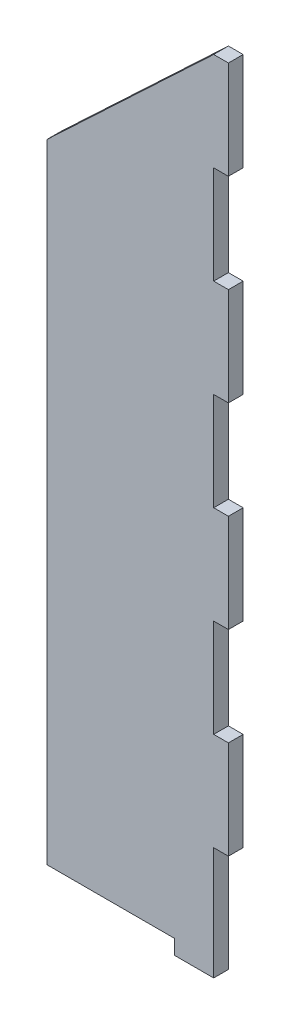
from build123d import *

# Parameters (mm, degrees)
BOSS_EXTRUDE1_DEPTH = 4.7625


with BuildPart() as part:
    # Sketch1 → Boss-Extrude1 (new body)
    with BuildSketch(Plane.XY):
        Polygon((-26.9875, -101.6), (14.2875, -101.6), (14.2875, -106.3625), (26.9875, -106.3625), (26.9875, -69.85), (31.75, -69.85), (31.75, -38.1), (26.9875, -38.1), (26.9875, -6.35), (31.75, -6.35), (31.75, 25.4), (26.9875, 25.4), (26.9875, 57.15), (31.75, 57.15), (31.75, 88.9), (26.9875, 88.9), (26.9875, 120.65), (31.75, 120.65), (31.75, 152.4), (26.9875, 152.4), (-26.9875, 101.6), align=None)
    extrude(amount=BOSS_EXTRUDE1_DEPTH)


solid = part.part
